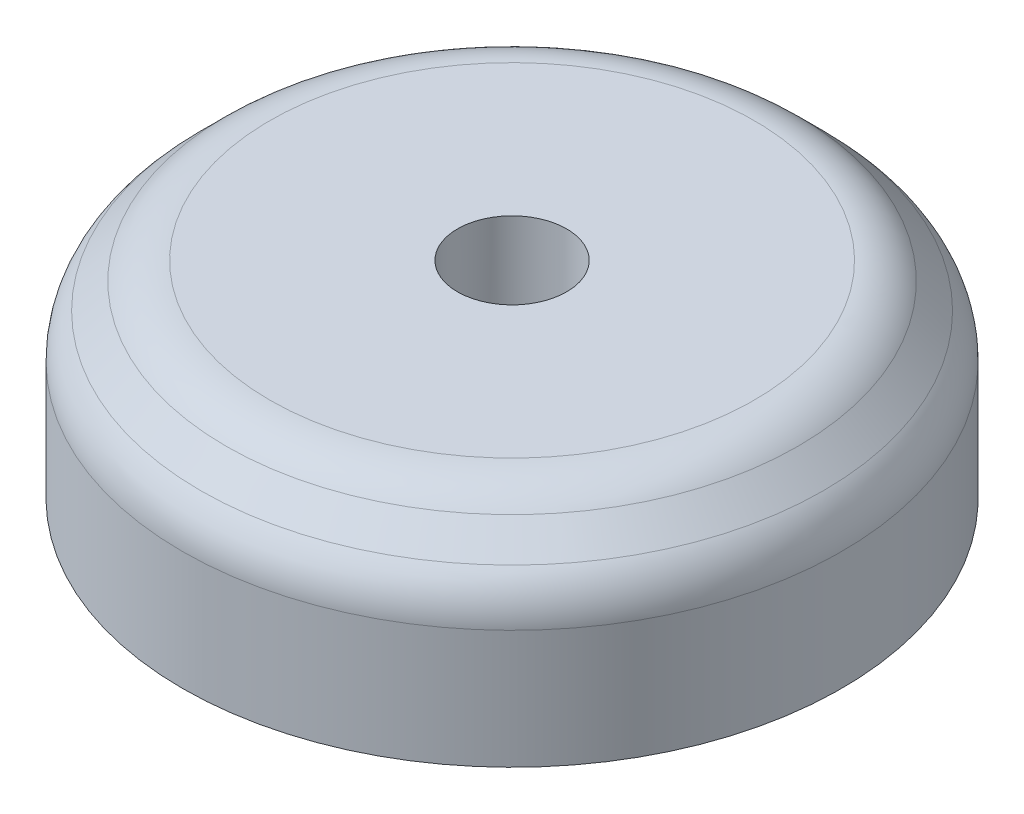
from build123d import *

# Parameters (mm, degrees)
SKETCH1_R           = 16
BOSS_EXTRUDE1_DEPTH = 10
CHAMFER1_SIZE       = 3
FILLET1_R           = 3
SKETCH2_R           = 2.65
CUT_EXTRUDE1_DEPTH  = 10
SKETCH3_R           = 15
CUT_EXTRUDE2_DEPTH  = 5


with BuildPart() as part:
    # Sketch1 → Boss-Extrude1 (new body)
    with BuildSketch(Plane(origin=(0, 0, 0), x_dir=(1, 0, 0), z_dir=(0, 1, 0))):
        with Locations(Location((0, 0, 0), (0, 0, 270))):
            Circle(SKETCH1_R)
    extrude(amount=BOSS_EXTRUDE1_DEPTH)

    # Chamfer1
    chamfer1_edges = [part.edges().sort_by_distance(p)[0] for p in [
        (0, 10, -16),
    ]]
    chamfer(chamfer1_edges, length=CHAMFER1_SIZE)

    # Fillet1
    fillet1_edges = [part.edges().sort_by_distance(p)[0] for p in [
        (0, 10, -13),
        (0, 7, -16),
    ]]
    fillet(fillet1_edges, radius=FILLET1_R)

    # Sketch2 → Cut-Extrude1 (cut)
    with BuildSketch(Plane(origin=(0, 10, 0), x_dir=(1, 0, 0), z_dir=(0, 1, 0))):
        with Locations(Location((0, 0, 0), (0, 0, 270))):
            Circle(SKETCH2_R)
    extrude(amount=-CUT_EXTRUDE1_DEPTH, mode=Mode.SUBTRACT)

    # Sketch3 → Cut-Extrude2 (cut)
    with BuildSketch(Plane.XZ):
        with Locations(Location((0, 0, 0), (0, 0, 270))):
            Circle(SKETCH3_R)
    extrude(amount=-CUT_EXTRUDE2_DEPTH, mode=Mode.SUBTRACT)


solid = part.part
